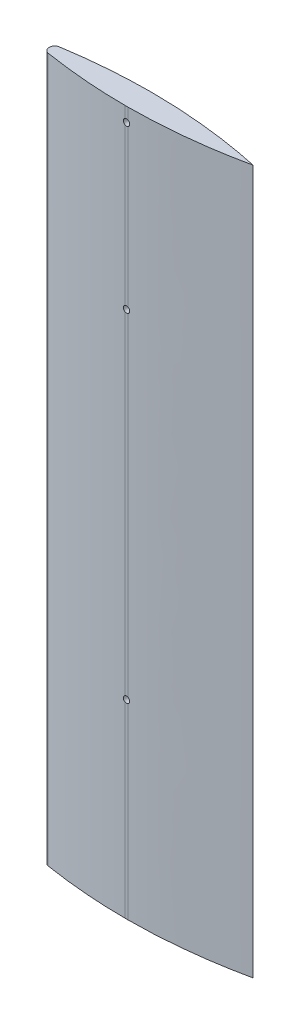
from build123d import *

# Parameters (mm, degrees)
BOSS_EXTRU_1_DEPTH = 1000
D_GAGEMENT_M81_D   = 9


with BuildPart() as part:
    # Esquisse1 → Boss.-Extru.1 (new body)
    with BuildSketch(Plane(origin=(0, 0, 0), x_dir=(1, 0, 0), z_dir=(0, 1, 0))):
        with BuildLine():
            Line((-15.630766153, 17.5), (-19.444429086, 17.5))
            add(Edge.make_bspline(
                [(-19.444429086, 17.5), (-78.965494885, 17.350025602), (-138.603987571, 7.837552161)],
                knots=[0.002589371, 0.002589371, 0.002589371, 0.422121029, 0.422121029, 0.422121029], degree=2))
            ThreePointArc((-138.603987571, 7.837552161), (-145, 3.763e-06), (-138.603994944, -7.837550652))
            add(Edge.make_bspline(
                [(-138.603994944, -7.837550652), (-78.96549857, -17.350025498), (-19.444429086, -17.5)],
                knots=[0.00013672, 0.00013672, 0.00013672, 0.419668405, 0.419668405, 0.419668405], degree=2))
            Line((-19.444429086, -17.5), (-15.630763785, -17.5))
            add(Edge.make_bspline(
                [(-15.630763785, -17.5), (64.79182114, -17.297347399), (145, 0)],
                knots=[0.433109057, 0.433109057, 0.433109057, 1, 1, 1], degree=2))
            add(Edge.make_bspline(
                [(-15.630766153, 17.5), (64.791819969, 17.297347525), (145, 0)],
                knots=[0.433109049, 0.433109049, 0.433109049, 1, 1, 1], degree=2))
        make_face()
    extrude(amount=BOSS_EXTRU_1_DEPTH)

    # Dégagement M81 (through all)
    with Locations(Plane(origin=(-17.5, 270, 17.5), x_dir=(1, 0, 0), z_dir=(0, 0, 1))):
        with Locations((0, 0), (0, 480), (0, 710)):
            Hole(D_GAGEMENT_M81_D / 2)


solid = part.part
